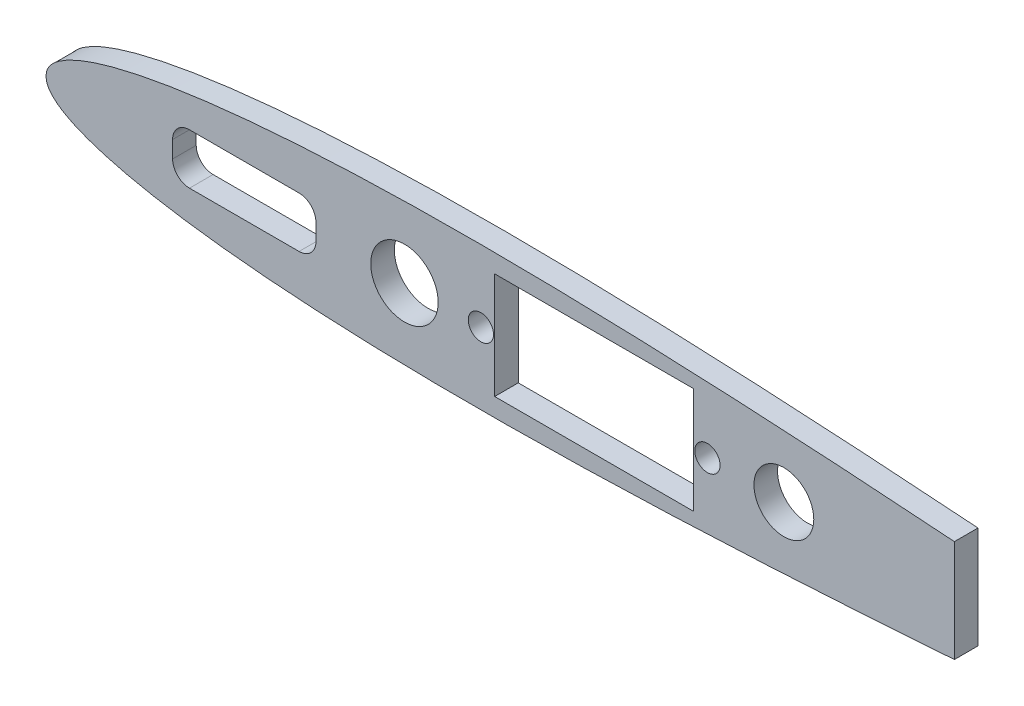
from build123d import *

# Parameters (mm, degrees)
SKETCH_1_R      = 4
SKETCH_1_W      = 23.6
SKETCH_1_H      = 12.6
SKETCH_1_R_2    = 1.5
SKETCH_1_R_3    = 3.55
EXTRUDE_1_DEPTH = 1.4


with BuildPart() as part:
    # Эскиз1 → Бобышка-Вытянуть1 (new, symmetric)
    with BuildSketch(Plane.XY):
        with BuildLine():
            Line((217.747634119, 2.35e-07), (217.747634119, 6.058113078))
            add(Edge.make_bspline(
                [(217.747634119, 6.058113078), (217.243808474, 6.094887376), (215.071311266, 6.252208631), (211.232977593, 6.52047435), (206.239642946, 6.848873), (201.268368917, 7.153826886), (196.331634567, 7.433105337), (191.441311474, 7.684604439), (186.608700127, 7.906218293), (181.844626933, 8.095958493), (177.159453511, 8.251957682), (172.563150272, 8.372486564), (168.065295924, 8.455953662), (163.675147454, 8.5010027), (159.401643404, 8.506522967), (155.253439756, 8.471528808), (151.238917925, 8.395506076), (147.366223919, 8.277985977), (143.643266298, 8.118975561), (140.077743555, 7.918678943), (136.677139412, 7.677604542), (133.448762895, 7.396480569), (130.399721686, 7.07642431), (127.536961089, 6.718650341), (124.867245825, 6.324666077), (122.397158974, 5.896120566), (120.133109351, 5.434797476), (118.081312133, 4.942567641), (116.247665798, 4.421392386), (114.63793972, 3.873060466), (113.256788366, 3.299309238), (112.109835923, 2.701306388), (111.196336341, 2.078555233), (110.530223642, 1.427069758), (110.085538218, 0.73423022), (110.027578176, 0.23672144), (110, 0)],
                knots=[0.362605011, 0.362605011, 0.362605011, 0.362605011, 0.371392651, 0.400495752, 0.429537687, 0.458441906, 0.487136113, 0.515551917, 0.543623846, 0.571289984, 0.59849081, 0.625169613, 0.651272029, 0.676746158, 0.701541791, 0.725611017, 0.748907835, 0.771387785, 0.793008139, 0.813728033, 0.833507815, 0.852309696, 0.87009731, 0.886835918, 0.902492782, 0.917037139, 0.930441054, 0.942679762, 0.953733567, 0.963589785, 0.972247019, 0.979722225, 0.986065145, 0.991385258, 0.995900989, 1, 1, 1, 1], degree=3))
            add(Edge.make_bspline(
                [(110, 0), (110.027578176, -0.23672144), (110.085538218, -0.73423022), (110.530223642, -1.427069758), (111.196336341, -2.078555233), (112.109835923, -2.701306388), (113.256788366, -3.299309238), (114.63793972, -3.873060466), (116.247665798, -4.421392386), (118.081312133, -4.942567641), (120.133109351, -5.434797476), (122.397158974, -5.896120566), (124.867245825, -6.324666077), (127.536961089, -6.718650341), (130.399721686, -7.07642431), (133.448762895, -7.396480569), (136.677139412, -7.677604542), (140.077743555, -7.918678943), (143.643266298, -8.118975561), (147.366223919, -8.277985977), (151.238917925, -8.395506076), (155.253439756, -8.471528808), (159.401643404, -8.506522967), (163.675147454, -8.5010027), (168.065295924, -8.455953662), (172.563150272, -8.372486564), (177.159453511, -8.251957682), (181.844626933, -8.095958493), (186.608700127, -7.906218293), (191.441311474, -7.684604439), (196.331634567, -7.433105337), (201.268368917, -7.153826886), (206.239642946, -6.848873), (211.232977593, -6.52047435), (215.071311266, -6.252208631), (217.243808474, -6.094887376), (217.747634119, -6.058113078)],
                knots=[0, 0, 0, 0, 0.004099011, 0.008614742, 0.013934855, 0.020277775, 0.027752981, 0.036410215, 0.046266433, 0.057320238, 0.069558946, 0.082962861, 0.097507218, 0.113164082, 0.12990269, 0.147690304, 0.166492185, 0.186271967, 0.206991861, 0.228612215, 0.251092165, 0.274388983, 0.298458209, 0.323253842, 0.348727971, 0.374830387, 0.40150919, 0.428710016, 0.456376154, 0.484448083, 0.512863887, 0.541558094, 0.570462313, 0.599504248, 0.628607349, 0.637394989, 0.637394989, 0.637394989, 0.637394989], degree=3))
            Line((217.747634119, -6.058113078), (217.747634119, 2.35e-07))
        make_face()
        with BuildLine():
            Line((140.01848428, -3), (127.01848428, -3))
            ThreePointArc((127.01848428, -3), (125.604270718, -2.414213562), (125.01848428, -1))
            Line((125.01848428, -1), (125.01848428, 1))
            ThreePointArc((125.01848428, 1), (125.604270718, 2.414213562), (127.01848428, 3))
            Line((127.01848428, 3), (140.01848428, 3))
            ThreePointArc((140.01848428, 3), (141.432697843, 2.414213562), (142.01848428, 1))
            Line((142.01848428, 1), (142.01848428, -1))
            ThreePointArc((142.01848428, -1), (141.432697843, -2.414213562), (140.01848428, -3))
        make_face(mode=Mode.SUBTRACT)
        with Locations((152.51848428, 0)):
            Circle(SKETCH_1_R, mode=Mode.SUBTRACT)
        with Locations((175.01848428, 0)):
            Rectangle(SKETCH_1_W, SKETCH_1_H, mode=Mode.SUBTRACT)
        with Locations((188.45348428, 0)):
            Circle(SKETCH_1_R_2, mode=Mode.SUBTRACT)
        with Locations((197.51848428, 0)):
            Circle(SKETCH_1_R_3, mode=Mode.SUBTRACT)
        with Locations((161.58348428, 0)):
            Circle(SKETCH_1_R_2, mode=Mode.SUBTRACT)
    extrude(amount=EXTRUDE_1_DEPTH, both=True)


solid = part.part
